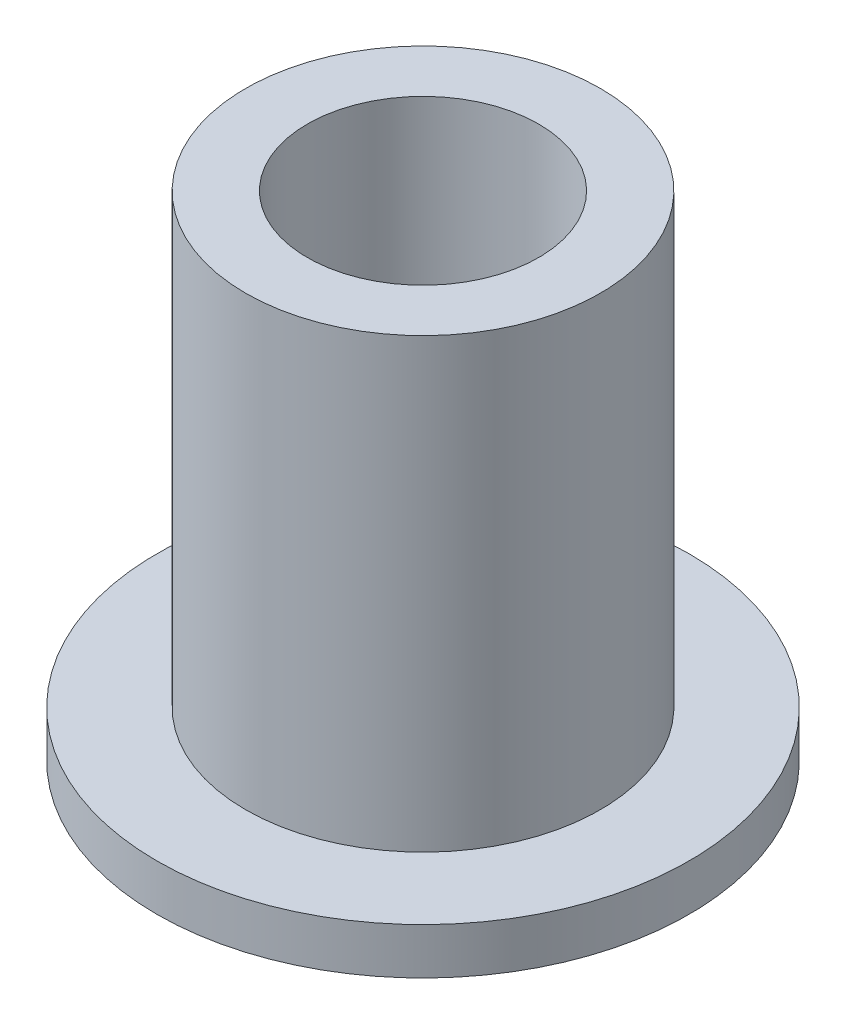
from build123d import *


with BuildPart() as part:
    # Sketch1 → Revolve1 (revolve)
    with BuildSketch(Plane.XY, mode=Mode.PRIVATE) as revolve1_sk:
        Polygon((1.5, 0), (3.45, 0), (3.45, 0.6), (2.3, 0.6), (2.3, 6.4), (1.5, 6.4), align=None)
    revolve(revolve1_sk.sketch.rotate(Axis((0, 0, 0), (0, 1, 0)), 90), axis=Axis((0, 0, 0), (0, 1, 0)))


solid = part.part
